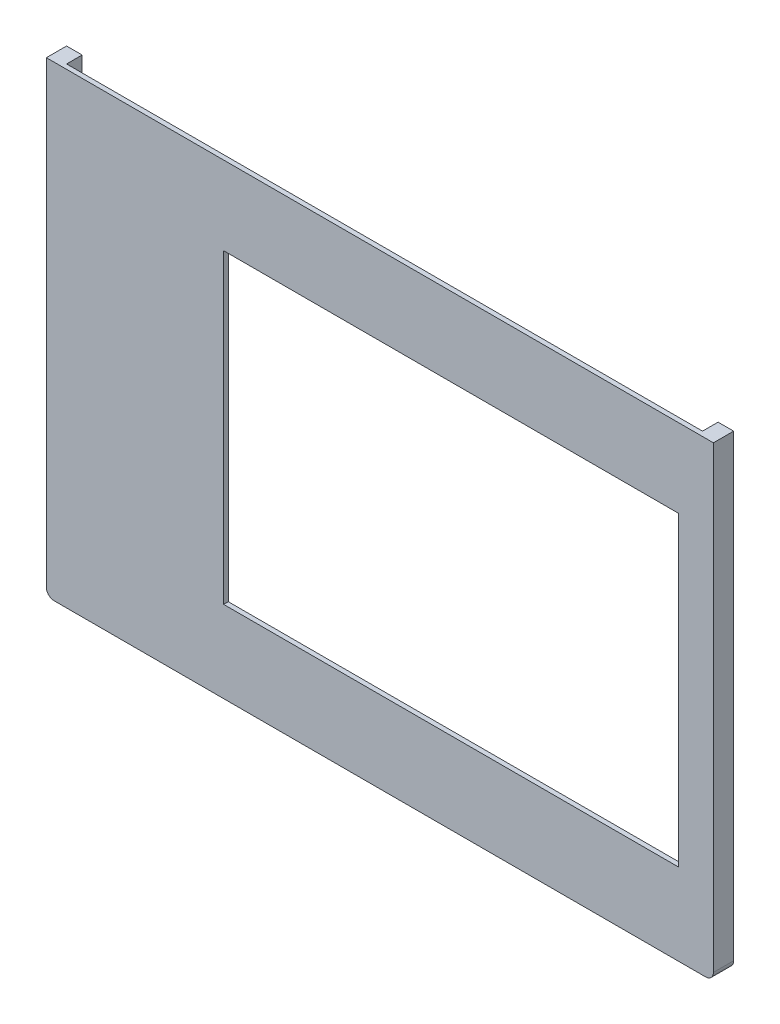
from build123d import *

# Parameters (mm, degrees)
SKETCH_1_W      = 85.8
SKETCH_1_H      = 60
SKETCH_1_W_2    = 58.5
SKETCH_1_H_2    = 39.4
EXTRUDE_1_DEPTH = 0.6
SKETCH_2_W      = 2
SKETCH_2_H      = 58
SKETCH_2_W_2    = 81.8
SKETCH_2_H_2    = 2
EXTRUDE_2_DEPTH = 2
FILLET_1_R      = 1


with BuildPart() as part:
    # 草图1 → 凸台-拉伸1 (new body)
    with BuildSketch(Plane.XY):
        Rectangle(SKETCH_1_W, SKETCH_1_H)
        with Locations((9.15, 0.2)):
            Rectangle(SKETCH_1_W_2, SKETCH_1_H_2, mode=Mode.SUBTRACT)
    extrude(amount=EXTRUDE_1_DEPTH)

    # 草图2 → 凸台-拉伸2 (add)
    with BuildSketch(Plane(origin=(0, 0, 0), x_dir=(-1, 0, 0), z_dir=(0, 0, -1))):
        with Locations((-41.9, 1)):
            Rectangle(SKETCH_2_W, SKETCH_2_H)
        with Locations((0, -29)):
            Rectangle(SKETCH_2_W_2, SKETCH_2_H_2)
        with Locations((-41.9, -29)):
            Rectangle(SKETCH_2_W, SKETCH_2_H_2)
        with Locations((41.9, 1)):
            Rectangle(SKETCH_2_W, SKETCH_2_H)
        with Locations((41.9, -29)):
            Rectangle(SKETCH_2_W, SKETCH_2_H_2)
    extrude(amount=EXTRUDE_2_DEPTH)

    # 圆角1
    fillet_1_edges = [part.edges().sort_by_distance(p)[0] for p in [
        (42.9, -30, -0.7),
        (-42.9, -30, -0.7),
    ]]
    fillet(fillet_1_edges, radius=FILLET_1_R)


solid = part.part
